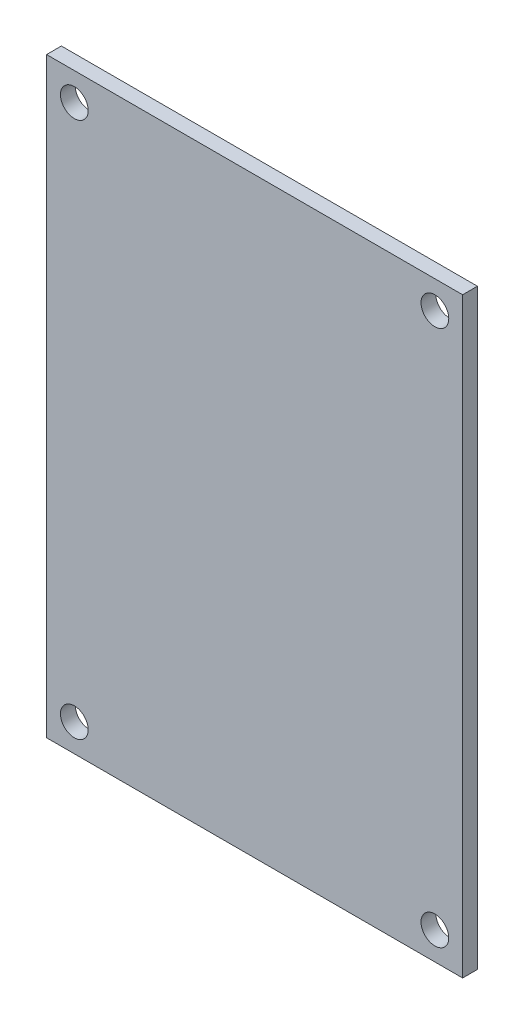
from build123d import *

# Parameters (mm, degrees)
SKETCH1_W           = 45
SKETCH1_H           = 64
BOSS_EXTRUDE1_DEPTH = 1.6
SKETCH2_R           = 1.5
CUT_EXTRUDE2_DEPTH  = 1.6


with BuildPart() as part:
    # Sketch1 → Boss-Extrude1 (new body)
    with BuildSketch(Plane.XY.offset(-57.4)):
        with Locations((-95.65, 0)):
            Rectangle(SKETCH1_W, SKETCH1_H)
    extrude(amount=BOSS_EXTRUDE1_DEPTH)

    # Sketch2 → Cut-Extrude2 (cut)
    with BuildSketch(Plane.XY.offset(-57.4)):
        with Locations((-115.15, -29)):
            Circle(SKETCH2_R)
        with Locations((-115.15, 29)):
            Circle(SKETCH2_R)
        with Locations((-76.15, -29)):
            Circle(SKETCH2_R)
        with Locations((-76.15, 29)):
            Circle(SKETCH2_R)
    extrude(amount=CUT_EXTRUDE2_DEPTH, mode=Mode.SUBTRACT)


solid = part.part
